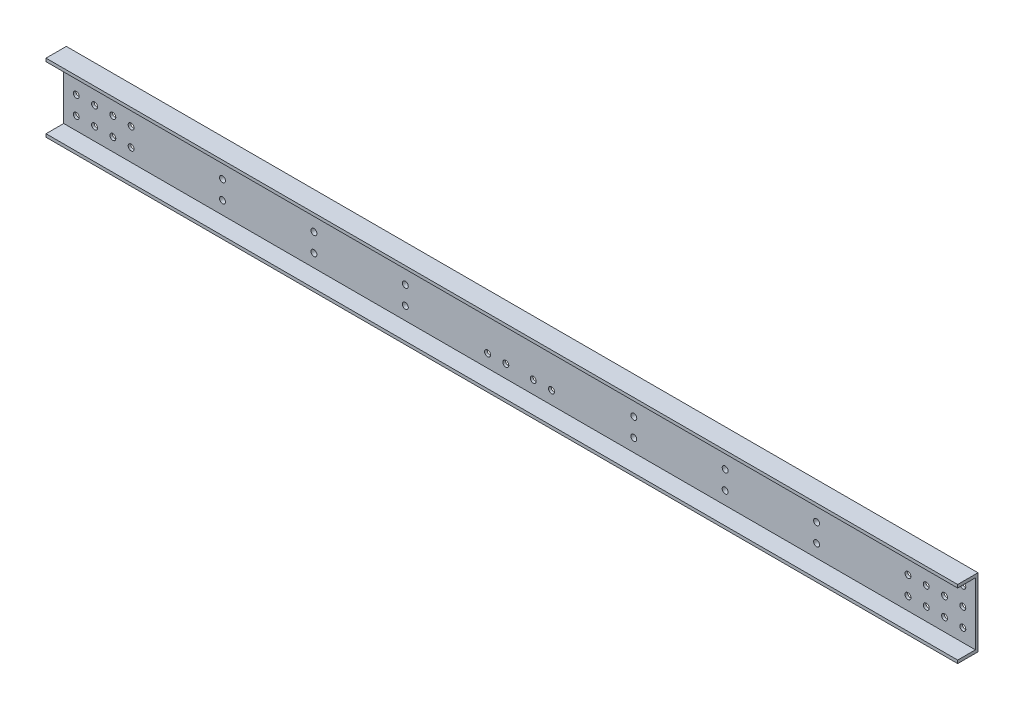
from build123d import *

# Parameters (mm, degrees)
SKETCH_1_W          = 3990
SKETCH_1_H          = 300
SKETCH_1_R          = 13
EXTRUDE_756_DEPTH   = 11.5
SKETCH_2_W          = 3990
SKETCH_2_H          = 13.5
EXTRUDE_1_DEPTH     = 77.5
SKETCH_3_W          = 70
SKETCH_3_H          = 230
EXTRUDE_2_DEPTH     = 16
SKETCH_4_R          = 13
CUT_EXTRUDE_1_DEPTH = 2004.38463606


with BuildPart() as part:
    # 草图1 → Extrude 756 (new body)
    with BuildSketch(Plane.XY):
        Rectangle(SKETCH_1_W, SKETCH_1_H)
        with Locations((1940, 0)):
            Circle(SKETCH_1_R, mode=Mode.SUBTRACT)
        with Locations((1860, 0)):
            Circle(SKETCH_1_R, mode=Mode.SUBTRACT)
        with Locations((1780, 0)):
            Circle(SKETCH_1_R, mode=Mode.SUBTRACT)
        with Locations((1700, 0)):
            Circle(SKETCH_1_R, mode=Mode.SUBTRACT)
        with Locations((1700, 80)):
            Circle(SKETCH_1_R, mode=Mode.SUBTRACT)
        with Locations((1780, 80)):
            Circle(SKETCH_1_R, mode=Mode.SUBTRACT)
        with Locations((1860, 80)):
            Circle(SKETCH_1_R, mode=Mode.SUBTRACT)
        with Locations((1940, 80)):
            Circle(SKETCH_1_R, mode=Mode.SUBTRACT)
        with Locations(Location((1940, -80, 0), (0, 0, 180))):
            Circle(SKETCH_1_R, mode=Mode.SUBTRACT)
        with Locations(Location((1860, -80, 0), (0, 0, 180))):
            Circle(SKETCH_1_R, mode=Mode.SUBTRACT)
        with Locations(Location((1780, -80, 0), (0, 0, 180))):
            Circle(SKETCH_1_R, mode=Mode.SUBTRACT)
        with Locations(Location((1700, -80, 0), (0, 0, 180))):
            Circle(SKETCH_1_R, mode=Mode.SUBTRACT)
        with Locations((-1700, -80)):
            Circle(SKETCH_1_R, mode=Mode.SUBTRACT)
        with Locations((-1780, -80)):
            Circle(SKETCH_1_R, mode=Mode.SUBTRACT)
        with Locations((-1860, -80)):
            Circle(SKETCH_1_R, mode=Mode.SUBTRACT)
        with Locations((-1940, -80)):
            Circle(SKETCH_1_R, mode=Mode.SUBTRACT)
        with Locations(Location((-1940, 80, 0), (0, 0, 180))):
            Circle(SKETCH_1_R, mode=Mode.SUBTRACT)
        with Locations(Location((-1860, 80, 0), (0, 0, 180))):
            Circle(SKETCH_1_R, mode=Mode.SUBTRACT)
        with Locations(Location((-1780, 80, 0), (0, 0, 180))):
            Circle(SKETCH_1_R, mode=Mode.SUBTRACT)
        with Locations(Location((-1700, 80, 0), (0, 0, 180))):
            Circle(SKETCH_1_R, mode=Mode.SUBTRACT)
        with Locations(Location((-1700, 0, 0), (0, 0, 180))):
            Circle(SKETCH_1_R, mode=Mode.SUBTRACT)
        with Locations(Location((-1780, 0, 0), (0, 0, 180))):
            Circle(SKETCH_1_R, mode=Mode.SUBTRACT)
        with Locations(Location((-1860, 0, 0), (0, 0, 180))):
            Circle(SKETCH_1_R, mode=Mode.SUBTRACT)
        with Locations(Location((-1940, 0, 0), (0, 0, 180))):
            Circle(SKETCH_1_R, mode=Mode.SUBTRACT)
        with Locations((60, 80)):
            Circle(SKETCH_1_R, mode=Mode.SUBTRACT)
        with Locations((140, 80)):
            Circle(SKETCH_1_R, mode=Mode.SUBTRACT)
        with Locations(Location((140, -80, 0), (0, 0, 180))):
            Circle(SKETCH_1_R, mode=Mode.SUBTRACT)
        with Locations(Location((60, -80, 0), (0, 0, 180))):
            Circle(SKETCH_1_R, mode=Mode.SUBTRACT)
        with Locations((-60, -80)):
            Circle(SKETCH_1_R, mode=Mode.SUBTRACT)
        with Locations((-140, -80)):
            Circle(SKETCH_1_R, mode=Mode.SUBTRACT)
        with Locations(Location((-140, 80, 0), (0, 0, 180))):
            Circle(SKETCH_1_R, mode=Mode.SUBTRACT)
        with Locations(Location((-60, 80, 0), (0, 0, 180))):
            Circle(SKETCH_1_R, mode=Mode.SUBTRACT)
    extrude(amount=EXTRUDE_756_DEPTH)

    # 草图2 → 凸台-拉伸1 (add)
    with BuildSketch(Plane.XY.offset(11.5)):
        with Locations((0, 143.25)):
            Rectangle(SKETCH_2_W, SKETCH_2_H)
        with Locations((0, -143.25)):
            Rectangle(SKETCH_2_W, SKETCH_2_H)
    extrude(amount=EXTRUDE_1_DEPTH)

    # 草图3 → 凸台-拉伸2 (add)
    with BuildSketch(Plane(origin=(0, 0, 0), x_dir=(-1, 0, 0), z_dir=(0, 0, -1))):
        with Locations((-1300, 0)):
            Rectangle(SKETCH_3_W, SKETCH_3_H)
        with Locations((-900, 0)):
            Rectangle(SKETCH_3_W, SKETCH_3_H)
        with Locations((-500, 0)):
            Rectangle(SKETCH_3_W, SKETCH_3_H)
        with Locations((500, 0)):
            Rectangle(SKETCH_3_W, SKETCH_3_H)
        with Locations((900, 0)):
            Rectangle(SKETCH_3_W, SKETCH_3_H)
        with Locations((1300, 0)):
            Rectangle(SKETCH_3_W, SKETCH_3_H)
    extrude(amount=EXTRUDE_2_DEPTH)

    # 草图4 → 切除-拉伸1 (cut, through all)
    with BuildSketch(Plane(origin=(0, 0, -16), x_dir=(-1, 0, 0), z_dir=(0, 0, -1))):
        with Locations((-1300, 0)):
            Circle(SKETCH_4_R)
        with Locations((-1300, 80)):
            Circle(SKETCH_4_R)
        with Locations((-900, 80)):
            Circle(SKETCH_4_R)
        with Locations((-900, 0)):
            Circle(SKETCH_4_R)
        with Locations((-500, 80)):
            Circle(SKETCH_4_R)
        with Locations((-500, 0)):
            Circle(SKETCH_4_R)
        with Locations(Location((-500, -80, 0), (0, 0, 180))):
            Circle(SKETCH_4_R)
        with Locations(Location((-900, -80, 0), (0, 0, 180))):
            Circle(SKETCH_4_R)
        with Locations(Location((-1300, -80, 0), (0, 0, 180))):
            Circle(SKETCH_4_R)
        with Locations((1300, -80)):
            Circle(SKETCH_4_R)
        with Locations((900, -80)):
            Circle(SKETCH_4_R)
        with Locations((500, -80)):
            Circle(SKETCH_4_R)
        with Locations(Location((500, 0, 0), (0, 0, 180))):
            Circle(SKETCH_4_R)
        with Locations(Location((500, 80, 0), (0, 0, 180))):
            Circle(SKETCH_4_R)
        with Locations(Location((900, 0, 0), (0, 0, 180))):
            Circle(SKETCH_4_R)
        with Locations(Location((900, 80, 0), (0, 0, 180))):
            Circle(SKETCH_4_R)
        with Locations(Location((1300, 80, 0), (0, 0, 180))):
            Circle(SKETCH_4_R)
        with Locations(Location((1300, 0, 0), (0, 0, 180))):
            Circle(SKETCH_4_R)
    extrude(amount=-CUT_EXTRUDE_1_DEPTH, mode=Mode.SUBTRACT)


solid = part.part
